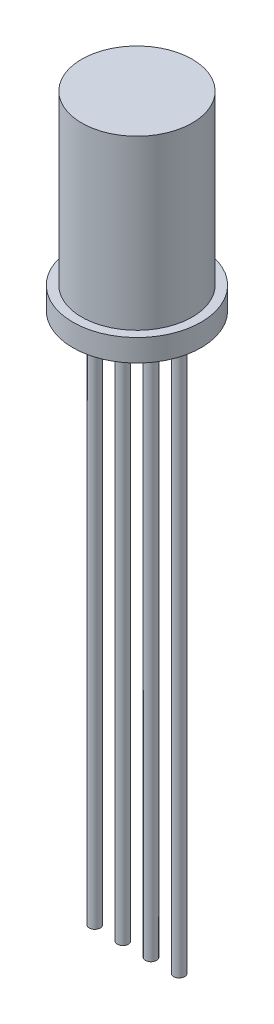
from build123d import *

# Parameters (mm, degrees)
LEADS_START   = -25
SK_LEADS_R    = 0.25
LEADS_DEPTH   = 25
LEADS_2_DEPTH = 25
LEADS_3_DEPTH = 25
LEADS_4_DEPTH = 25
SK_FLANGE_R   = 2.9
FLANGE_DEPTH  = 1
LENS_START    = 1
SK_LENS_R     = 2.5
LENS_DEPTH    = 7.6


with BuildPart() as part:
    # SK Leads → Leads (new body)
    with BuildSketch(Plane(origin=(0, 0, 0), x_dir=(1, 0, 0), z_dir=(0, 1, 0)).offset(LEADS_START)):
        with Locations(Location((-1.905, 0, 0), (0, 0, 270))):
            Circle(SK_LEADS_R)
    extrude(amount=LEADS_DEPTH)


with BuildPart() as body_2:
    # SK Leads → Leads 2 (new body)
    with BuildSketch(Plane(origin=(0, 0, 0), x_dir=(1, 0, 0), z_dir=(0, 1, 0)).offset(LEADS_START)):
        with Locations(Location((-0.635, 0, 0), (0, 0, 270))):
            Circle(SK_LEADS_R)
    extrude(amount=LEADS_2_DEPTH)


with BuildPart() as body_3:
    # SK Leads → Leads 3 (new body)
    with BuildSketch(Plane(origin=(0, 0, 0), x_dir=(1, 0, 0), z_dir=(0, 1, 0)).offset(LEADS_START)):
        with Locations(Location((0.635, 0, 0), (0, 0, 270))):
            Circle(SK_LEADS_R)
    extrude(amount=LEADS_3_DEPTH)


with BuildPart() as body_4:
    # SK Leads → Leads 4 (new body)
    with BuildSketch(Plane(origin=(0, 0, 0), x_dir=(1, 0, 0), z_dir=(0, 1, 0)).offset(LEADS_START)):
        with Locations(Location((1.905, 0, 0), (0, 0, 270))):
            Circle(SK_LEADS_R)
    extrude(amount=LEADS_4_DEPTH)


with BuildPart() as body_5:
    # SK Flange → Flange (new body)
    with BuildSketch(Plane(origin=(0, 0, 0), x_dir=(1, 0, 0), z_dir=(0, 1, 0))):
        with Locations(Location((0, 0, 0), (0, 0, 270))):
            Circle(SK_FLANGE_R)
    extrude(amount=FLANGE_DEPTH)


with BuildPart() as body_6:
    # SK Lens → Lens (new body)
    with BuildSketch(Plane(origin=(0, 0, 0), x_dir=(1, 0, 0), z_dir=(0, 1, 0)).offset(LENS_START)):
        with Locations(Location((0, 0, 0), (0, 0, 90))):
            Circle(SK_LENS_R)
    extrude(amount=LENS_DEPTH)


solid = Compound([part.part, body_2.part, body_3.part, body_4.part, body_5.part, body_6.part])
